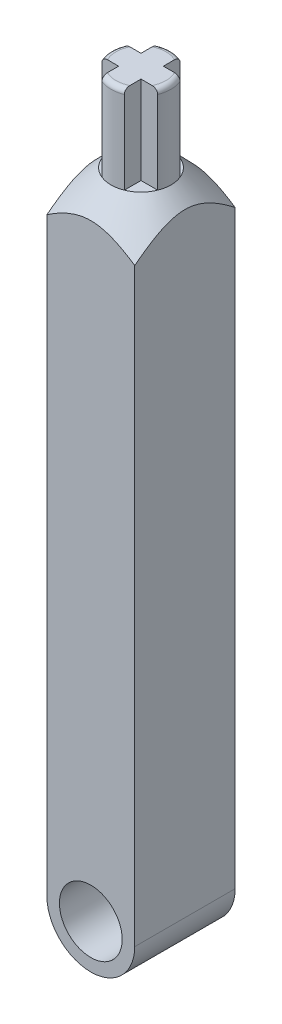
from build123d import *

# Parameters (mm, degrees)
SKETCH_1_R      = 2.5
EXTRUDE_1_DEPTH = 8
EXTRUDE_3_DEPTH = 7
FILLET_1_R      = 0.4


with BuildPart() as part:
    # ｽｹｯﾁ1 → ﾎﾞｽ - 押し出し1 (new body)
    with BuildSketch(Plane.XY):
        with BuildLine():
            Line((-3.5, 0), (-3.5, 50))
            Line((-3.5, 50), (3.5, 50))
            Line((3.5, 50), (3.5, 0))
            ThreePointArc((3.5, 0), (0, -3.5), (-3.5, 0))
        make_face()
        Circle(SKETCH_1_R, mode=Mode.SUBTRACT)
    extrude(amount=EXTRUDE_1_DEPTH)

    # ｽｹｯﾁ2 → ﾎﾞｽ - 押し出し3 (add)
    with BuildSketch(Plane(origin=(0, 50, 0), x_dir=(1, 0, 0), z_dir=(0, 1, 0))):
        with BuildLine():
            Line((-0.89, -1.781892699), (-0.89, -3.11))
            Line((-0.89, -3.11), (-2.218107301, -3.11))
            ThreePointArc((-2.218107301, -3.11), (-2.39, -4), (-2.218107301, -4.89))
            Line((-2.218107301, -4.89), (-0.89, -4.89))
            Line((-0.89, -4.89), (-0.89, -6.218107301))
            ThreePointArc((-0.89, -6.218107301), (0, -6.39), (0.89, -6.218107301))
            Line((0.89, -6.218107301), (0.89, -4.89))
            Line((0.89, -4.89), (2.218107301, -4.89))
            ThreePointArc((2.218107301, -4.89), (2.39, -4), (2.218107301, -3.11))
            Line((2.218107301, -3.11), (0.89, -3.11))
            Line((0.89, -3.11), (0.89, -1.781892699))
            ThreePointArc((0.89, -1.781892699), (0, -1.61), (-0.89, -1.781892699))
        make_face()
    extrude(amount=EXTRUDE_3_DEPTH)

    # ﾌｨﾚｯﾄ1
    fillet_1_edges = [part.edges().sort_by_distance(p)[0] for p in [
        (0, 57, 1.61),
        (-2.39, 57, 4),
        (0, 57, 6.39),
        (2.39, 57, 4),
    ]]
    fillet(fillet_1_edges, radius=FILLET_1_R)

    # ｽｹｯﾁ5 → ｶｯﾄ - 回転2 (revolve, cut)
    with BuildSketch(Plane(origin=(-1.982300885, 0, 1.734513274), x_dir=(0.6585046078685183, 0, 0.7525766947068778), z_dir=(-0.7525766947068777, 0, 0.6585046078685182)), mode=Mode.PRIVATE) as cut_revolve_2_sk:
        Polygon((0.620306779, 50), (-2.304766128, 47), (-2.304766128, 50), align=None)
    revolve(cut_revolve_2_sk.sketch.rotate(Axis((0, 57, 4), (0, -1, 0)), 19.323147236), axis=Axis((0, 57, 4), (0, -1, 0)), mode=Mode.SUBTRACT)


solid = part.part
